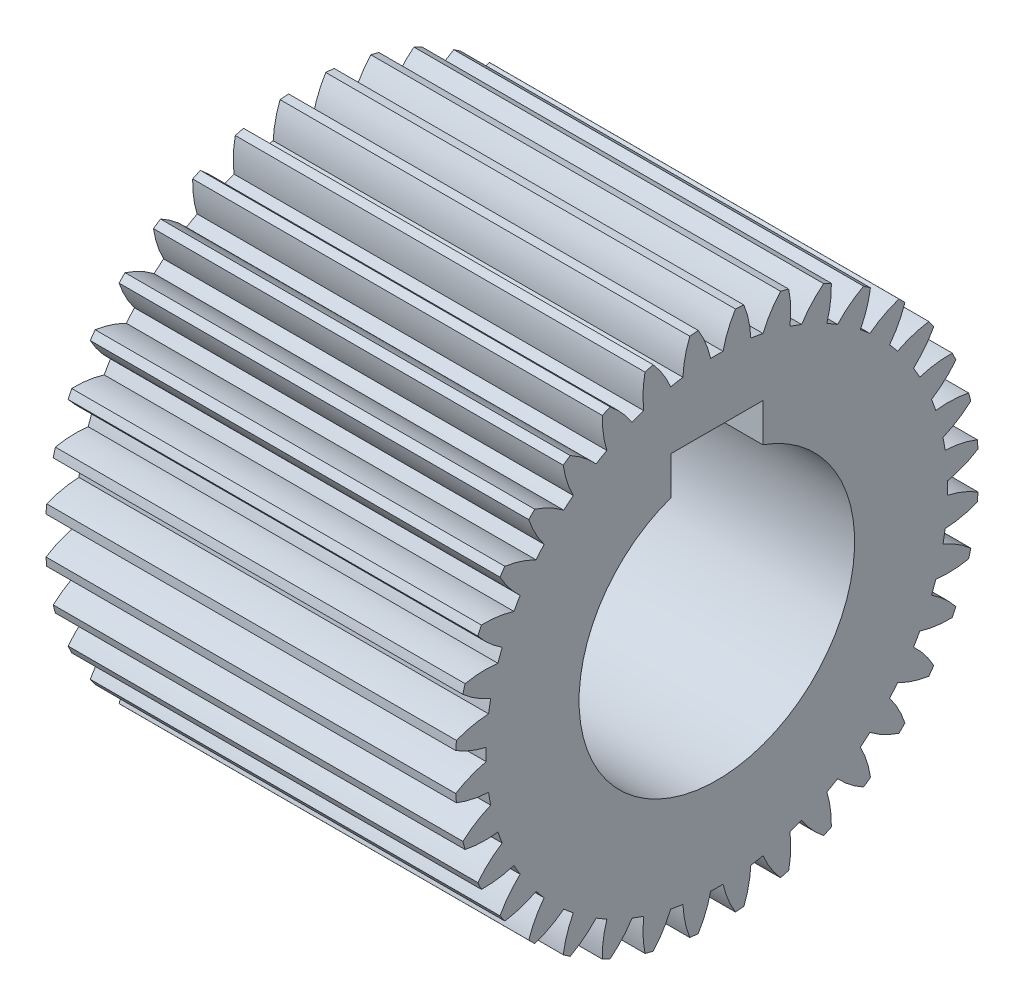
from build123d import *

# Parameters (mm, degrees)
BASPROSKE_W     = 44.6
BASPROSKE_H     = 28.5
TOOTHCUT_DEPTH  = 61.113725554
TEETHCUTS_COUNT = 36
TEETHCUTS_ANGLE = 350
BORSKE_R        = 15
BORE_DEPTH      = 50.0000508
KEYSKE_W        = 10
KEYSKE_H        = 18.3
KEYWAY_DEPTH    = 50.0000508


with BuildPart() as part:
    # BasProSke → Base-Revolve (revolve)
    with BuildSketch(Plane(origin=(0, 0, 0), x_dir=(1, 0, 0), z_dir=(0, 1, 0)), mode=Mode.PRIVATE) as base_revolve_sk:
        with Locations((22.3, 14.25)):
            Rectangle(BASPROSKE_W, BASPROSKE_H)
    revolve(base_revolve_sk.sketch.rotate(Axis((-10, 0, 0), (1, 0, 0)), 180), axis=Axis((-10, 0, 0), (1, 0, 0)))

    # TooCutSke → ToothCut (cut, through all)
    with BuildSketch(Plane(origin=(0, 0, 0), x_dir=(0, 0, -1), z_dir=(1, 0, 0))):
        with BuildLine():
            ThreePointArc((0.675592044, 25.114914919), (0, 25.124), (-0.675592044, 25.114914919))
            ThreePointArc((-0.675592044, 25.114914919), (-1.216753237, 26.840960635), (-2.038403685, 28.452475386))
            ThreePointArc((-2.038403685, 28.452475386), (0, 28.5254), (2.038403685, 28.452475386))
            ThreePointArc((2.038403685, 28.452475386), (1.216753237, 26.840960635), (0.675592044, 25.114914919))
        make_face()
    toothcut = extrude(amount=TOOTHCUT_DEPTH, mode=Mode.SUBTRACT)

    # TeethCuts: ToothCut ×36 about axis
    teethcuts_axis = Axis((-10, 0, 0), (1, 0, 0))
    for i in range(1, TEETHCUTS_COUNT):
        add(toothcut.rotate(teethcuts_axis, i * TEETHCUTS_ANGLE / (TEETHCUTS_COUNT - 1)), mode=Mode.SUBTRACT)

    # BorSke → Bore (cut, symmetric)
    with BuildSketch(Plane(origin=(0, 0, 0), x_dir=(0, 0, -1), z_dir=(1, 0, 0))):
        with Locations(Location((0, 0, 0), (0, 0, 180))):
            Circle(BORSKE_R)
    extrude(amount=BORE_DEPTH, both=True, mode=Mode.SUBTRACT)

    # KeySke → Keyway (cut, symmetric)
    with BuildSketch(Plane(origin=(0, 0, 0), x_dir=(0, 0, -1), z_dir=(1, 0, 0))):
        with Locations((0, 9.15)):
            Rectangle(KEYSKE_W, KEYSKE_H)
    extrude(amount=KEYWAY_DEPTH, both=True, mode=Mode.SUBTRACT)


solid = part.part
